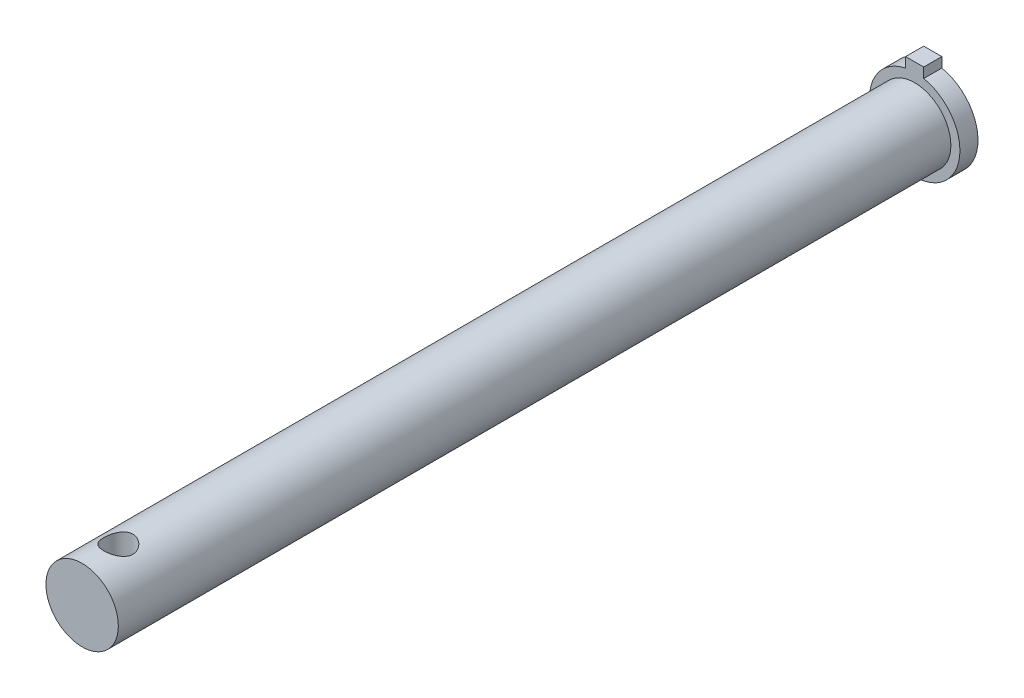
from build123d import *

# Parameters (mm, degrees)
SKETCH1_R                = 12.5
BOSS_EXTRUDE1_DEPTH      = 5
SKETCH3_R                = 10
BOSS_EXTRUDE2_DEPTH      = 230
CUT_EXTRUDE1_DEPTH       = 236.663955666
CUT_EXTRUDE1_DEPTH_BACK  = 236.663955666
SKETCH4_R                = 4
BOSS_EXTRUDE3_REACH      = 238.934
BOSS_EXTRUDE3_END_RADIUS = 12.5
SKETCH5_W                = 5
SKETCH5_H                = 5


with BuildPart() as part:
    # Sketch1 → Boss-Extrude1 (new body)
    with BuildSketch(Plane.XY):
        Circle(SKETCH1_R)
    extrude(amount=BOSS_EXTRUDE1_DEPTH)

    # Sketch3 → Boss-Extrude2 (add)
    with BuildSketch(Plane.XY.offset(5)):
        Circle(SKETCH3_R)
    extrude(amount=BOSS_EXTRUDE2_DEPTH)

    # Sketch4 → Cut-Extrude1 (cut, two sides: drawn at the far end of the back side and taken through both)
    with BuildSketch(Plane(origin=(0, 0, 0), x_dir=(1, 0, 0), z_dir=(0, 1, 0)).offset(-CUT_EXTRUDE1_DEPTH_BACK)):
        with Locations(Location((0, -225, 0), (0, 0, 270))):
            Circle(SKETCH4_R)
    extrude(amount=CUT_EXTRUDE1_DEPTH + CUT_EXTRUDE1_DEPTH_BACK, mode=Mode.SUBTRACT)

    # Boss-Extrude3: up to this cylinder (the profile starts outside it)
    boss_extrude3_end = Plane(origin=(0, 0, 2.5), z_dir=(0, 0, -1)) * Cylinder(BOSS_EXTRUDE3_END_RADIUS, 503.868, mode=Mode.PRIVATE)
    # Sketch5 → Boss-Extrude3 (add, up to the surface)
    with BuildSketch(Plane(origin=(0, 15, 0), x_dir=(1, 0, 0), z_dir=(0, 1, 0)), mode=Mode.PRIVATE) as boss_extrude3_sk1:
        with Locations((0, -2.5)):
            Rectangle(SKETCH5_W, SKETCH5_H)
    boss_extrude3_tool1 = extrude(boss_extrude3_sk1.sketch, amount=-BOSS_EXTRUDE3_REACH, mode=Mode.PRIVATE) - boss_extrude3_end
    add(boss_extrude3_tool1.solids().sort_by_distance((0, 15, 2.5))[0])


solid = part.part
